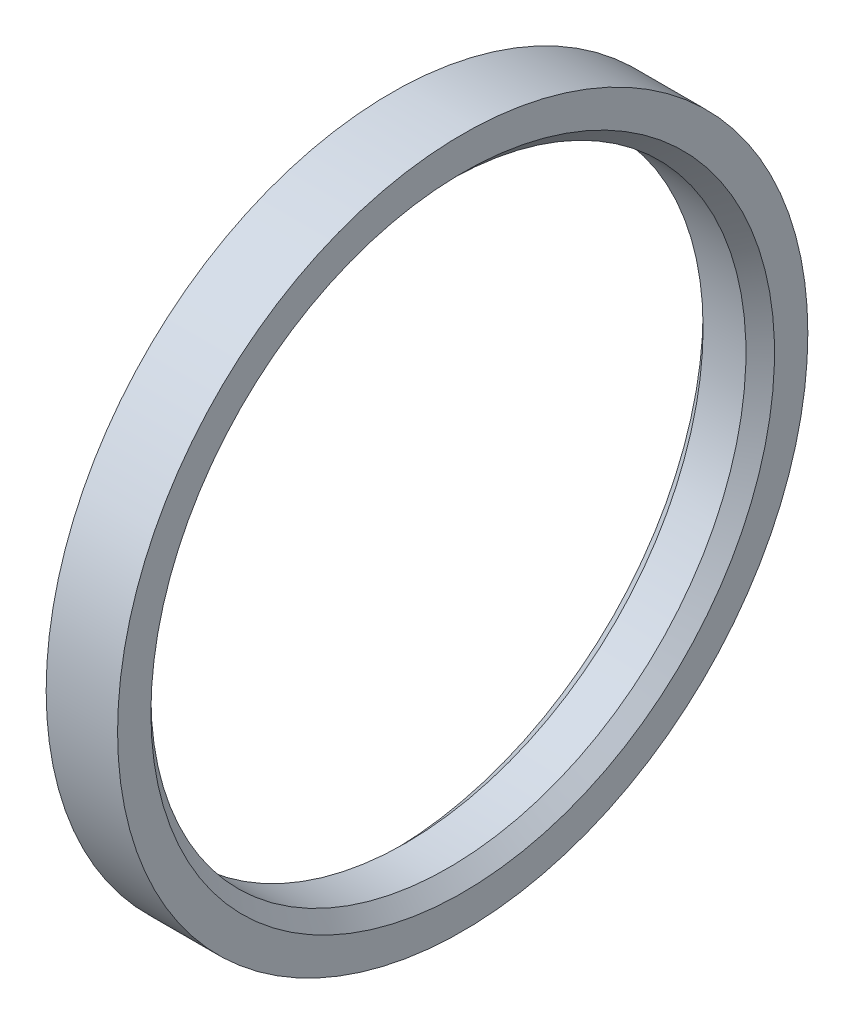
from build123d import *

# Parameters (mm, degrees)
SKETCH_1_W     = 3
SKETCH_1_H     = 2
CHAMFER_1_SIZE = 0.6


with BuildPart() as part:
    # Эскиз1 → Повернуть1 (revolve)
    with BuildSketch(Plane.XY, mode=Mode.PRIVATE) as revolve_1_sk:
        with Locations((1.5, 13.5)):
            Rectangle(SKETCH_1_W, SKETCH_1_H)
    revolve(revolve_1_sk.sketch.rotate(Axis((0, 0, 0), (1, 0, 0)), 90), axis=Axis((0, 0, 0), (1, 0, 0)))

    # Фаска1
    chamfer_1_edges = [part.edges().sort_by_distance(p)[0] for p in [
        (3, 0, -12.5),
        (0, 0, -12.5),
    ]]
    chamfer(chamfer_1_edges, length=CHAMFER_1_SIZE)


solid = part.part
